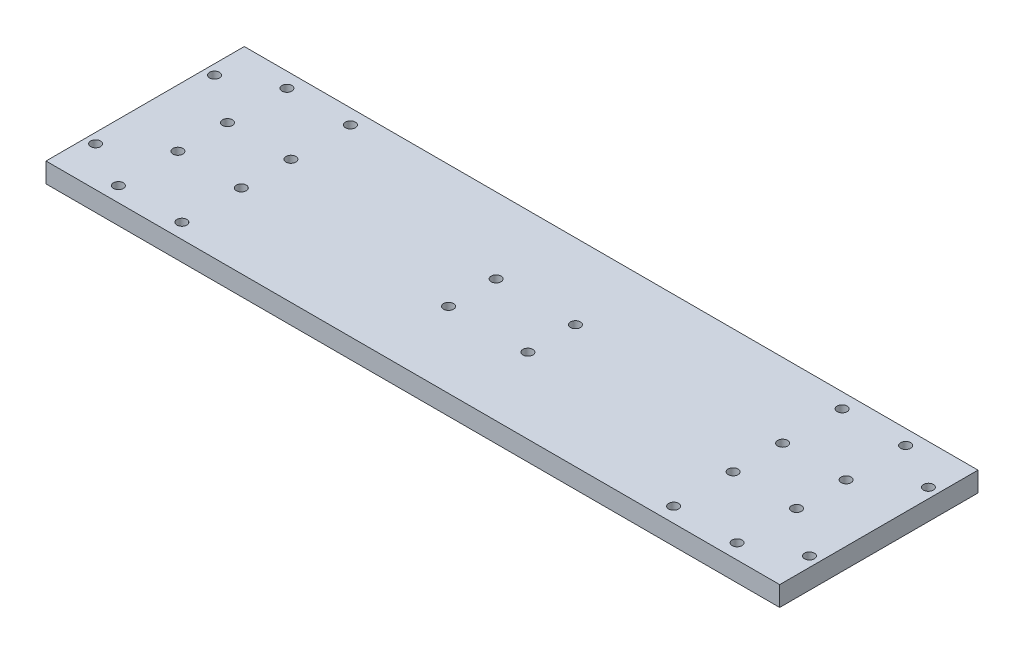
from build123d import *

# Parameters (mm, degrees)
SKETCH1_W           = 370
SKETCH1_H           = 100
BOSS_EXTRUDE1_DEPTH = 10
SKETCH3_R           = 2.5
CUT_EXTRUDE1_DEPTH  = 192.898410624


with BuildPart() as part:
    # Sketch1 → Boss-Extrude1 (new body)
    with BuildSketch(Plane(origin=(0, 0, 0), x_dir=(1, 0, 0), z_dir=(0, 1, 0))):
        Rectangle(SKETCH1_W, SKETCH1_H)
    extrude(amount=BOSS_EXTRUDE1_DEPTH)

    # Sketch3 → Cut-Extrude1 (cut, through all)
    with BuildSketch(Plane.XZ):
        with Locations(Location((-156, 42.5, 0), (0, 0, 270))):
            Circle(SKETCH3_R)
        with Locations(Location((-124, 42.5, 0), (0, 0, 270))):
            Circle(SKETCH3_R)
        with Locations(Location((124, 42.5, 0), (0, 0, 270))):
            Circle(SKETCH3_R)
        with Locations(Location((156, 42.5, 0), (0, 0, 270))):
            Circle(SKETCH3_R)
        with Locations(Location((-156, 12.5, 0), (0, 0, 270))):
            Circle(SKETCH3_R)
        with Locations(Location((-124, 12.5, 0), (0, 0, 270))):
            Circle(SKETCH3_R)
        with Locations(Location((124, 12.5, 0), (0, 0, 270))):
            Circle(SKETCH3_R)
        with Locations(Location((156, 12.5, 0), (0, 0, 270))):
            Circle(SKETCH3_R)
        with Locations(Location((-156, -12.5, 0), (0, 0, 270))):
            Circle(SKETCH3_R)
        with Locations(Location((-124, -12.5, 0), (0, 0, 270))):
            Circle(SKETCH3_R)
        with Locations(Location((124, -12.5, 0), (0, 0, 270))):
            Circle(SKETCH3_R)
        with Locations(Location((156, -12.5, 0), (0, 0, 270))):
            Circle(SKETCH3_R)
        with Locations(Location((-156, -42.5, 0), (0, 0, 270))):
            Circle(SKETCH3_R)
        with Locations(Location((-124, -42.5, 0), (0, 0, 270))):
            Circle(SKETCH3_R)
        with Locations(Location((124, -42.5, 0), (0, 0, 270))):
            Circle(SKETCH3_R)
        with Locations(Location((156, -42.5, 0), (0, 0, 270))):
            Circle(SKETCH3_R)
        with Locations(Location((-20, 12, 0), (0, 0, 270))):
            Circle(SKETCH3_R)
        with Locations(Location((20, 12, 0), (0, 0, 270))):
            Circle(SKETCH3_R)
        with Locations(Location((20, -12, 0), (0, 0, 270))):
            Circle(SKETCH3_R)
        with Locations(Location((-20, -12, 0), (0, 0, 270))):
            Circle(SKETCH3_R)
        with Locations(Location((-180, 30, 0), (0, 0, 270))):
            Circle(SKETCH3_R)
        with Locations(Location((-180, -30, 0), (0, 0, 270))):
            Circle(SKETCH3_R)
        with Locations(Location((180, -30, 0), (0, 0, 270))):
            Circle(SKETCH3_R)
        with Locations(Location((180, 30, 0), (0, 0, 270))):
            Circle(SKETCH3_R)
    extrude(amount=-CUT_EXTRUDE1_DEPTH, mode=Mode.SUBTRACT)


solid = part.part
